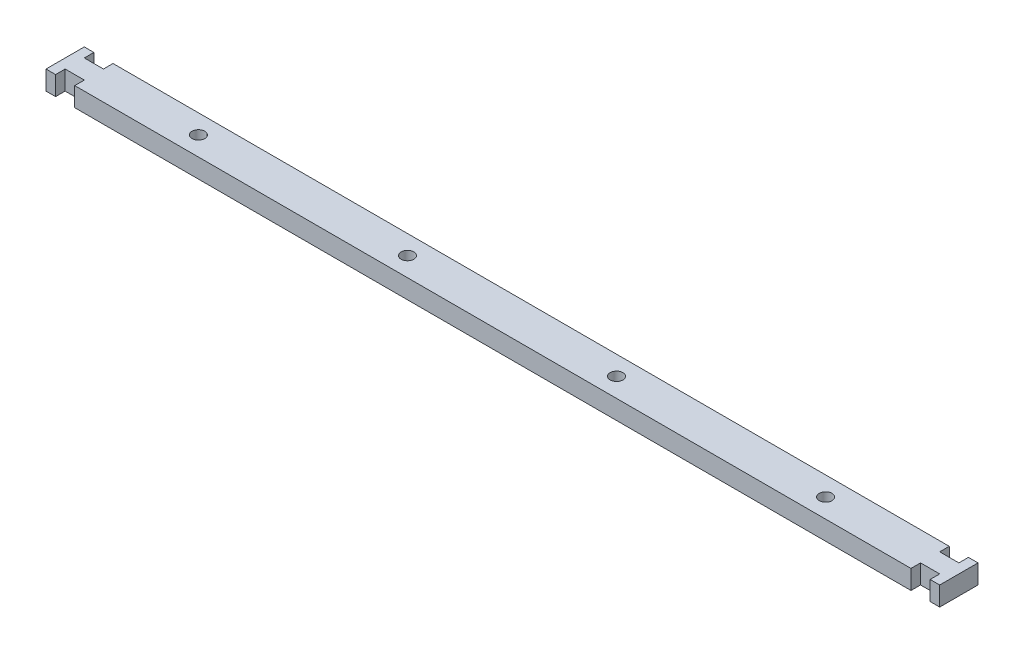
from build123d import *

# Parameters (mm, degrees)
SKETCH1_W               = 137
SKETCH1_H               = 6
BOSS_EXTRUDE1_DEPTH     = 3
SKETCH2_W               = 3
SKETCH2_H               = 1.5
CUT_EXTRUDE1_DEPTH      = 3
MIRROR2_COPY_1_SKETCH_W = 3
MIRROR2_COPY_1_SKETCH_H = 1.5
MIRROR2_COPY_1_DEPTH    = 3
BOSS_EXTRUDE2_DEPTH     = 3
CUT_EXTRUDE2_DEPTH      = 3


with BuildPart() as part:
    # Sketch1 → Boss-Extrude1 (new body)
    with BuildSketch(Plane(origin=(0, 0, 0), x_dir=(1, 0, 0), z_dir=(0, 1, 0))):
        Rectangle(SKETCH1_W, SKETCH1_H)
    extrude(amount=BOSS_EXTRUDE1_DEPTH)

    # Sketch2 → Cut-Extrude1 (cut)
    with BuildSketch(Plane(origin=(0, 3, 0), x_dir=(1, 0, 0), z_dir=(0, 1, 0))):
        with Locations((67, 2.25)):
            Rectangle(SKETCH2_W, SKETCH2_H)
    cut_extrude1 = extrude(amount=-CUT_EXTRUDE1_DEPTH, mode=Mode.SUBTRACT)

    # Mirror1: Cut-Extrude1 across plane
    add(cut_extrude1.mirror(Plane.XY), mode=Mode.SUBTRACT)

    # Mirror2: Cut-Extrude1 across plane
    add(cut_extrude1.mirror(Plane(origin=(0, 0, 0), x_dir=(0, 0, 1), z_dir=(1, 0, 0))), mode=Mode.SUBTRACT)

    # Mirror2 copy 1 sketch → Mirror2 copy 1 (cut)
    with BuildSketch(Plane(origin=(0, 3, 0), x_dir=(-1, 0, 0), z_dir=(0, 1, 0))):
        with Locations((67, 2.25)):
            Rectangle(MIRROR2_COPY_1_SKETCH_W, MIRROR2_COPY_1_SKETCH_H)
    extrude(amount=-MIRROR2_COPY_1_DEPTH, mode=Mode.SUBTRACT)

    # Sketch3 → Boss-Extrude2 (add)
    with BuildSketch(Plane(origin=(0, 3, 0), x_dir=(1, 0, 0), z_dir=(0, 1, 0))):
        Polygon((70, 3), (68.5, 3), (68.5, 1.5), (68.5, -1.5), (68.5, -3), (70, -3), align=None)
    boss_extrude2 = extrude(amount=-BOSS_EXTRUDE2_DEPTH)

    # Mirror3: Boss-Extrude2 across plane
    add(boss_extrude2.mirror(Plane(origin=(0, 0, 0), x_dir=(0, 0, 1), z_dir=(1, 0, 0))))

    # Sketch4 → Cut-Extrude2 (cut)
    with BuildSketch(Plane(origin=(0, 3, 0), x_dir=(1, 0, 0), z_dir=(0, 1, 0))):
        with BuildLine():
            ThreePointArc((-50.125, 0), (-49.125, -1), (-48.125, 0))
            Line((-48.125, 0), (-50.125, 0))
        make_face()
        with BuildLine():
            Line((-50.125, 0), (-48.125, 0))
            ThreePointArc((-48.125, 0), (-49.125, 1), (-50.125, 0))
        make_face()
        with BuildLine():
            ThreePointArc((-15.375, 0), (-16.375, 1), (-17.375, 0))
            Line((-17.375, 0), (-15.375, 0))
        make_face()
        with BuildLine():
            Line((-15.375, 0), (-17.375, 0))
            ThreePointArc((-17.375, 0), (-16.375, -1), (-15.375, 0))
        make_face()
    cut_extrude2 = extrude(amount=-CUT_EXTRUDE2_DEPTH, mode=Mode.SUBTRACT)

    # Mirror4: Cut-Extrude2 across plane
    add(cut_extrude2.mirror(Plane(origin=(0, 0, 0), x_dir=(0, 0, 1), z_dir=(1, 0, 0))), mode=Mode.SUBTRACT)


solid = part.part
